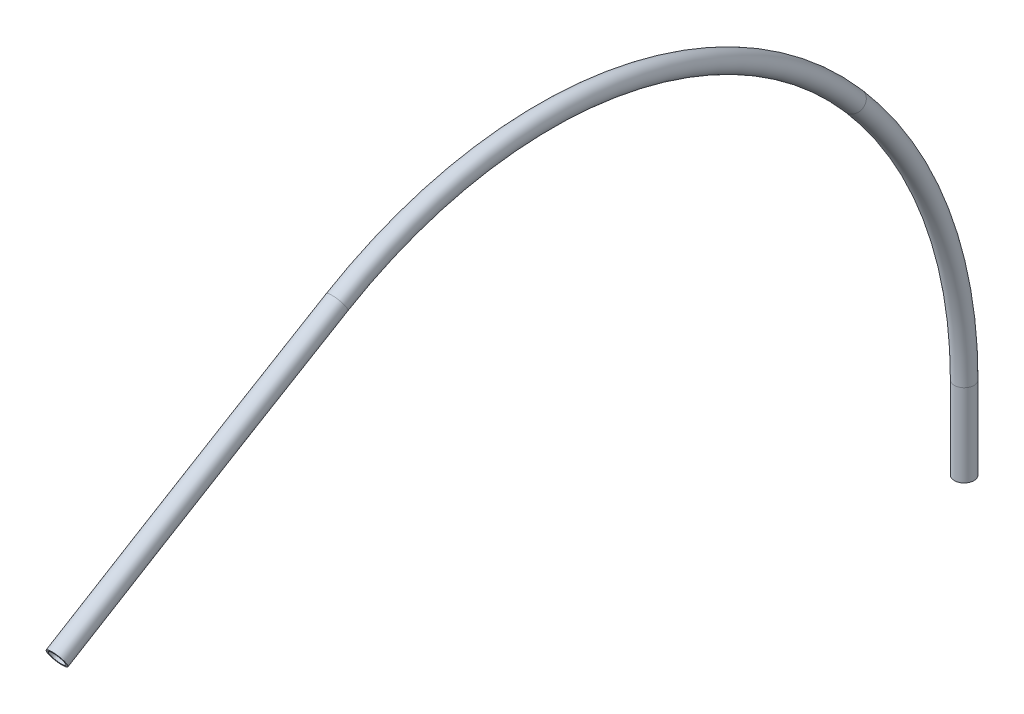
from build123d import *

# Parameters (mm, degrees)
CROQUIS7_R = 5
VACIADO2_T = -1


with BuildPart() as part:
    # Barrer1: sweep along a path in Croquis5
    with BuildLine(Plane(origin=(0, 0, 0), x_dir=(0, 0, -1), z_dir=(1, 0, 0))) as barrer1_path:
        Line((-12, 40), (-12, 82.205417262))
        ThreePointArc((-12, 82.205417262), (-26.544036789, 163.089452311), (-68.354058477, 233.840270104))
        ThreePointArc((-68.354058477, 233.840270104), (-192.782537214, 303.529868669), (-332.920608455, 277.064656453))
        ThreePointArc((-332.920608455, 277.064656453), (-404.710677086, 234.183935346), (-476.226198503, 190.846879685))
    # Croquis7 → Barrer1 (sweep)
    with BuildSketch(Plane(origin=(0, 40, 12), x_dir=(-1, 0, 0), z_dir=(0, 1, 0))):
        Circle(CROQUIS7_R)
    sweep(path=barrer1_path.line)

    # Vaciado2
    vaciado2_openings = [part.faces().sort_by_distance(p)[0] for p in [
        (0, 190.846879685, 476.226198503),
        (0, 40, 12),
    ]]
    offset(amount=VACIADO2_T, openings=vaciado2_openings, kind=Kind.INTERSECTION)


solid = part.part
